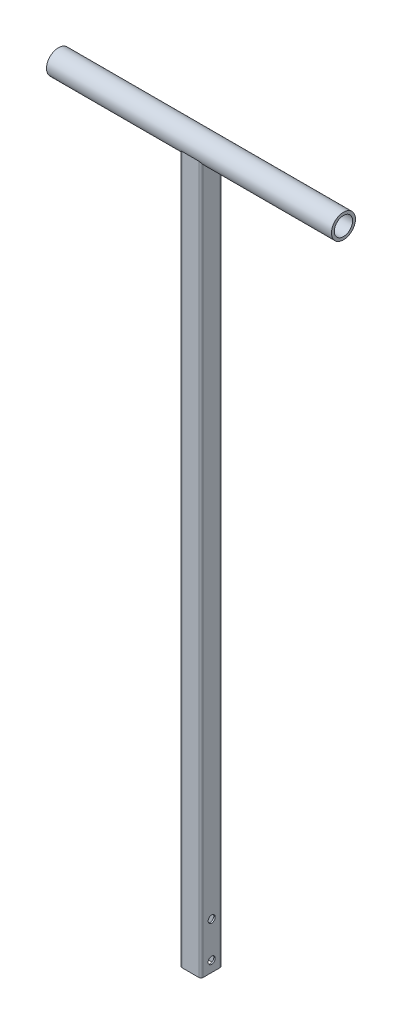
from build123d import *

# Parameters (mm, degrees)
SQUARE_TUBE_CONFIGURED_40_X_40_X_4_1_DEPTH = 1000
SKETCH11_R                                 = 16.85
SKETCH11_R_2                               = 12.85
PIPE_CONFIGURED_33_7_X_4_0_2_DEPTH         = 400
ESBO_O5_R                                  = 5
CORTE_EXTRUS_O1_DEPTH                      = 1023.990187001


with BuildPart() as part:
    # Sketch12 → Square tube - configured 40 X 40 X 4(1) (new body)
    with BuildSketch(Plane(origin=(200, 0, 0), x_dir=(1, 0, 0), z_dir=(0, -1, 0))):
        with BuildLine():
            Line((-12, -15), (12, -15))
            ThreePointArc((12, -15), (14.121320344, -14.121320344), (15, -12))
            Line((15, -12), (15, 12))
            ThreePointArc((15, 12), (14.121320344, 14.121320344), (12, 15))
            Line((12, 15), (-12, 15))
            ThreePointArc((-12, 15), (-14.121320344, 14.121320344), (-15, 12))
            Line((-15, 12), (-15, -12))
            ThreePointArc((-15, -12), (-14.121320344, -14.121320344), (-12, -15))
        make_face()
        with BuildLine():
            Line((-12, -13), (12, -13))
            ThreePointArc((12, -13), (12.707106781, -12.707106781), (13, -12))
            Line((13, -12), (13, 12))
            ThreePointArc((13, 12), (12.707106781, 12.707106781), (12, 13))
            Line((12, 13), (-12, 13))
            ThreePointArc((-12, 13), (-12.707106781, 12.707106781), (-13, 12))
            Line((-13, 12), (-13, -12))
            ThreePointArc((-13, -12), (-12.707106781, -12.707106781), (-12, -13))
        make_face(mode=Mode.SUBTRACT)
    extrude(amount=SQUARE_TUBE_CONFIGURED_40_X_40_X_4_1_DEPTH)


with BuildPart() as body_2:
    # Sketch11 → Pipe - configured 33.7 X 4.0(2) (new body)
    with BuildSketch(Plane.YZ):
        Circle(SKETCH11_R)
        Circle(SKETCH11_R_2, mode=Mode.SUBTRACT)
    extrude(amount=PIPE_CONFIGURED_33_7_X_4_0_2_DEPTH)


with BuildPart() as part_1:
    add(part.part)

    # Aparar/Estender1: cut back where it meets the other member's skin (coped)
    split(bisect_by=body_2.part.faces().sort_by_distance((200, -16.85, 0))[0], keep=Keep.TOP)

    # Esboço5 → Corte-extrusão1 (cut, through all)
    with BuildSketch(Plane(origin=(215, 0, 0), x_dir=(0, 0, -1), z_dir=(1, 0, 0))):
        with Locations(Location((0, -985, 0), (0, 0, 90))):
            Circle(ESBO_O5_R)
        with Locations(Location((0, -935, 0), (0, 0, 90))):
            Circle(ESBO_O5_R)
    extrude(amount=-CORTE_EXTRUS_O1_DEPTH, mode=Mode.SUBTRACT)


solid = Compound([body_2.part, part_1.part])
